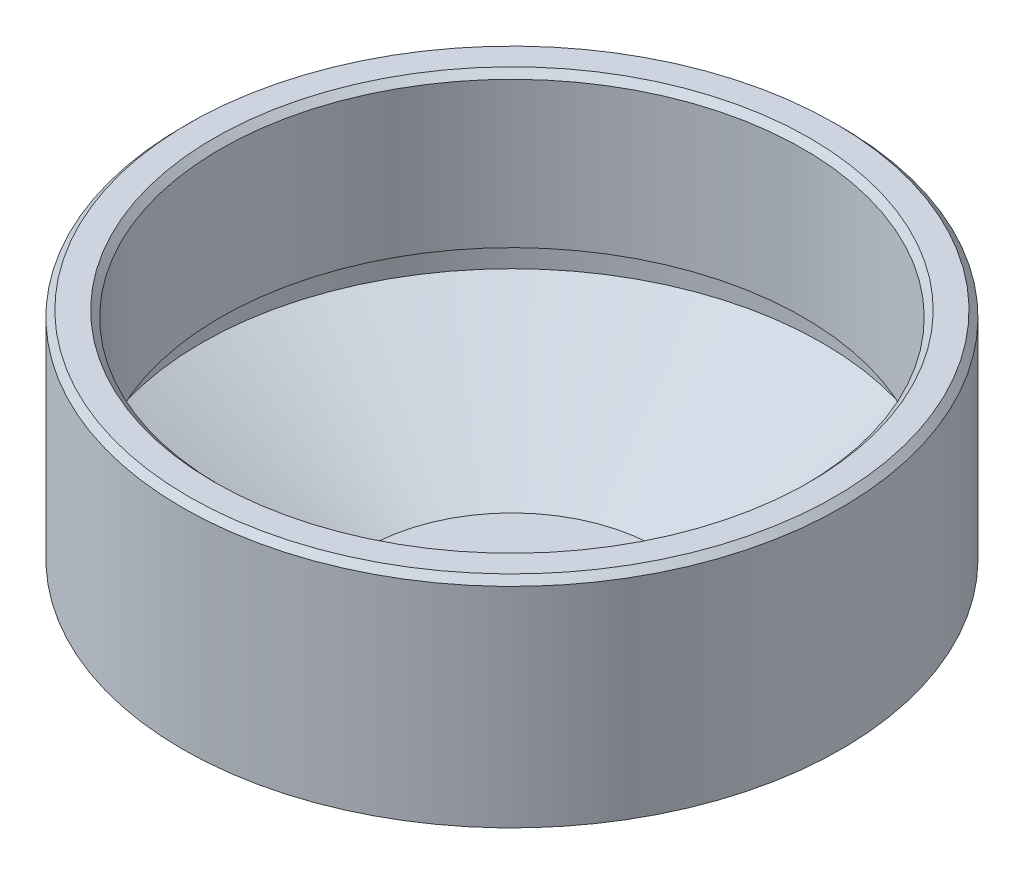
from build123d import *

# Parameters (mm, degrees)
CHAMFER_1_SIZE = 0.5


with BuildPart() as part:
    # Эскиз1 → Повернуть1 (revolve)
    with BuildSketch(Plane.XY):
        Polygon((-26, 28), (-26, 11), (-6.947441117, 0), (-3, 0), (-3, 6), (-11.509618943, 6), (-24.5, 13.5), (-24.5, 16), (-23, 16), (-23, 28), align=None)
    revolve(axis=Axis((0, 26.168985987, 0), (0, -1, 0)))

    # Фаска1
    chamfer_1_edges = [part.edges().sort_by_distance(p)[0] for p in [
        (3, 0, 0),
        (26, 28, 0),
        (23, 28, 0),
    ]]
    chamfer(chamfer_1_edges, length=CHAMFER_1_SIZE)


solid = part.part
